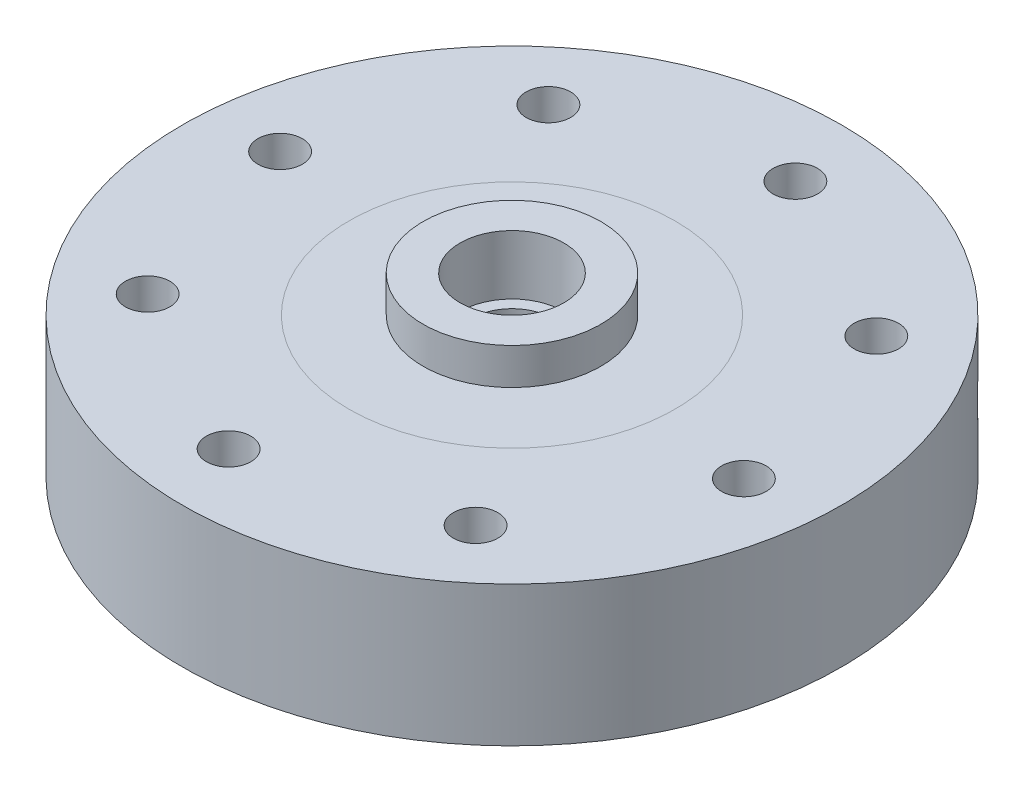
from build123d import *

# Parameters (mm, degrees)
SKETCH1_R             = 44.45
BODY_EXTRUSION_DEPTH  = 50.8
SKETCH7_R             = 7
INLET_TAP_DEPTH       = 8
SKETCH6_R             = 5.4102
DE_DEPTH              = 100
OUTLET_TAP_DEPTH      = 10
OUTLET_TAP_DEPTH_BACK = 8
SKETCH13_R            = 4
SKETCH14_W            = 44.45
SKETCH14_H            = 26.970473788
SKETCH17_R            = 3
BOLT_HOLES_DEPTH      = 50.8
BOLT_PATTERN_COUNT    = 8


with BuildPart() as part:
    # Sketch1 → body extrusion (new body)
    with BuildSketch(Plane(origin=(0, 0, 0), x_dir=(1, 0, 0), z_dir=(0, 1, 0))):
        with Locations(Location((0, 0, 0), (0, 0, 270))):
            Circle(SKETCH1_R)
    extrude(amount=BODY_EXTRUSION_DEPTH)

    # Sketch7 → inlet tap (cut)
    with BuildSketch(Plane(origin=(0, 50.8, 0), x_dir=(1, 0, 0), z_dir=(0, 1, 0))):
        with Locations(Location((0, 0, 0), (0, 0, 270))):
            Circle(SKETCH7_R)
    extrude(amount=-INLET_TAP_DEPTH, mode=Mode.SUBTRACT)

    # Sketch6 → De (cut)
    with BuildSketch(Plane(origin=(0, 50.8, 0), x_dir=(1, 0, 0), z_dir=(0, 1, 0))):
        with Locations(Location((0, 0, 0), (0, 0, 270))):
            Circle(SKETCH6_R)
    extrude(amount=-DE_DEPTH, mode=Mode.SUBTRACT)

    # Sketch2 → main chamber (revolve, cut)
    with BuildSketch(Plane.XY, mode=Mode.PRIVATE) as main_chamber_sk:
        Polygon((0, 31.970473788), (0, 38.8), (5.4102, 38.8), (27.1319, 38.780473788), (27.1319, 31.970473788), (27.1319, 0), (0, 0), align=None)
    revolve(main_chamber_sk.sketch.rotate(Axis((0, 31.970473788, 0), (0, 1, 0)), 90), axis=Axis((0, 31.970473788, 0), (0, 1, 0)), mode=Mode.SUBTRACT)

    # Sketch11 → conical outlet (revolve, cut)
    with BuildSketch(Plane(origin=(-6.384797532, 0, -23.828388787), x_dir=(0.9659258262890693, 0, -0.2588190451025173), z_dir=(0.2588190451025173, 0, 0.9659258262890693)), mode=Mode.PRIVATE) as conical_outlet_sk:
        Polygon((6.610028802, 38.370571699), (106.229498611, 47.086145974), (106.229498611, 36.875473788), (6.610028802, 36.875473788), align=None)
    revolve(conical_outlet_sk.sketch.rotate(Axis((0, 36.875473788, -25.539190129), (0.9659258262890693, 0, -0.2588190451025173)), 221.089323042), axis=Axis((0, 36.875473788, -25.539190129), (0.9659258262890693, 0, -0.2588190451025173)), mode=Mode.SUBTRACT)

    # Sketch13 → outlet tap (cut, two sides: drawn at the far end of the back side and taken through both)
    with BuildSketch(Plane(origin=(32.895788814, 0, -8.814400047), x_dir=(-0.25881904510251785, 0, -0.9659258262890692), z_dir=(0.9659258262890692, 0, -0.25881904510251785)).offset(-OUTLET_TAP_DEPTH_BACK)):
        with Locations(Location((24.668963328, 36.875473788, 0), (0, 0, 307.245050492))):
            Circle(SKETCH13_R)
    extrude(amount=OUTLET_TAP_DEPTH + OUTLET_TAP_DEPTH_BACK, mode=Mode.SUBTRACT)

    # Sketch14 → upper and lower main cuts (revolve, cut)
    with BuildSketch(Plane.XY, mode=Mode.PRIVATE) as upper_and_lower_main_cuts_sk:
        Polygon((12, 50.8), (12, 45.88446305), (21.99999596, 45.875473788), (44.45, 45.875473788), (44.45, 50.8), align=None)
        with Locations((22.225, 13.485236894)):
            Rectangle(SKETCH14_W, SKETCH14_H)
    revolve(upper_and_lower_main_cuts_sk.sketch.rotate(Axis((0, 0, 0), (0, 1, 0)), 90), axis=Axis((0, 0, 0), (0, 1, 0)), mode=Mode.SUBTRACT)

    # Sketch17 → bolt holes (cut)
    with BuildSketch(Plane(origin=(0, 45.875473788, 0), x_dir=(1, 0, 0), z_dir=(0, 1, 0))):
        with Locations(Location((3.472737472, 34.751916774, 0), (0, 0, 270))):
            Circle(SKETCH17_R)
    bolt_holes = extrude(amount=-BOLT_HOLES_DEPTH, mode=Mode.SUBTRACT)

    # bolt pattern: bolt holes ×8 about axis
    bolt_pattern_axis = Axis((0, 0, 0), (0, 1, 0))
    for i in range(1, BOLT_PATTERN_COUNT):
        add(bolt_holes.rotate(bolt_pattern_axis, i * 360 / BOLT_PATTERN_COUNT), mode=Mode.SUBTRACT)


solid = part.part
